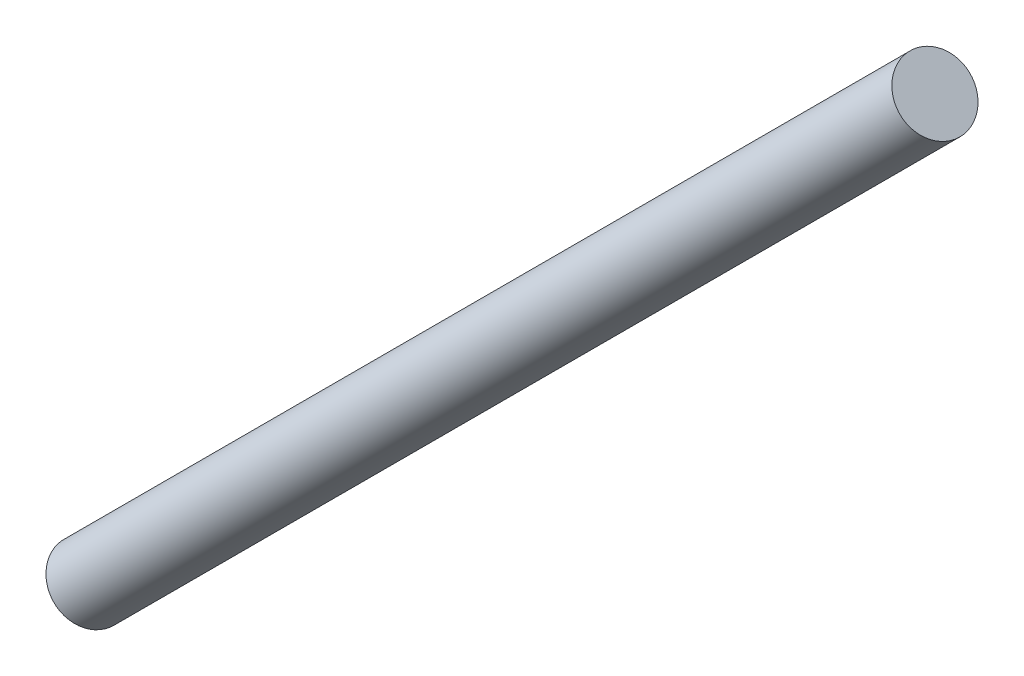
from build123d import *

# Parameters (mm, degrees)
SKETCH2_R           = 5
BOSS_EXTRUDE1_DEPTH = 170


with BuildPart() as part:
    # Sketch2 → Boss-Extrude1 (new body)
    with BuildSketch(Plane(origin=(94.859307055, 94.859307055, 0), x_dir=(0, 0, 1), z_dir=(-0.707106781186544, -0.7071067811865511, 0))):
        with Locations(Location((-10, -38.456734122, 0), (0, 0, 270))):
            Circle(SKETCH2_R)
    extrude(amount=BOSS_EXTRUDE1_DEPTH)


solid = part.part
